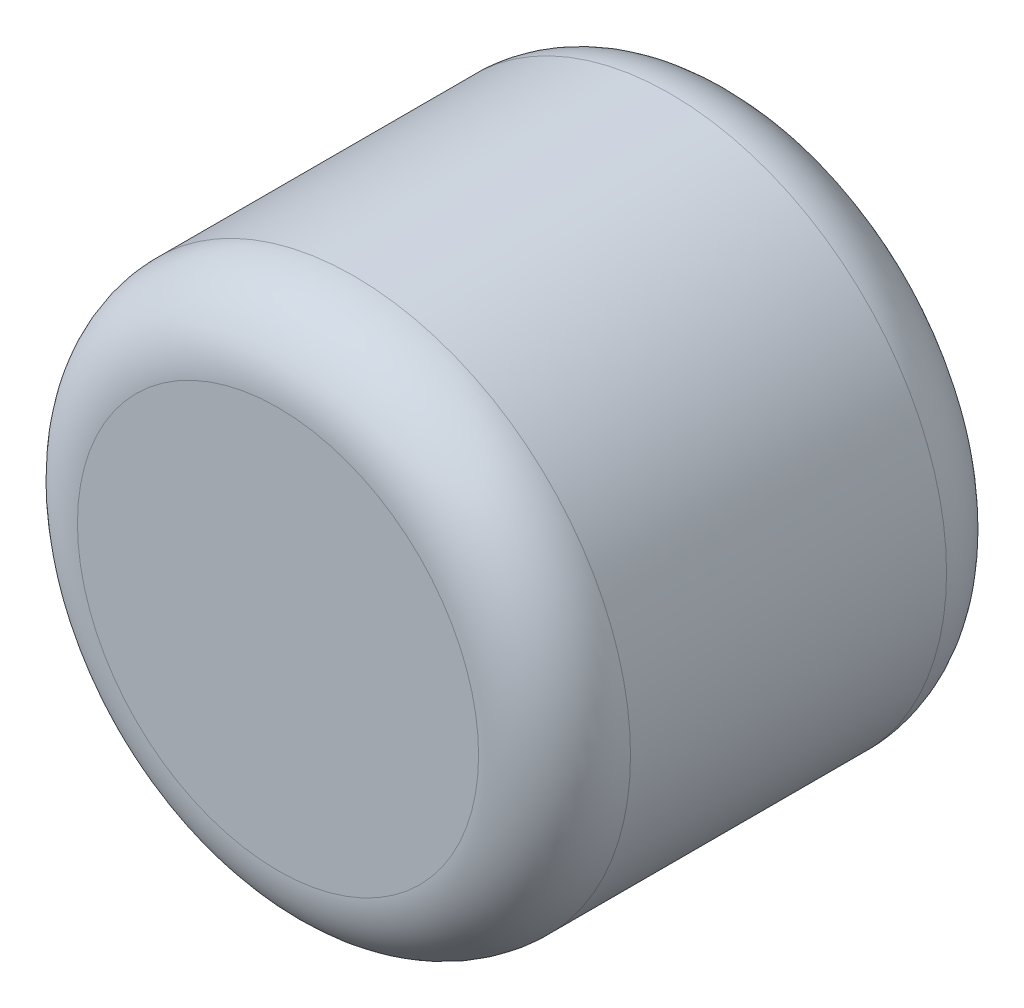
from build123d import *

# Parameters (mm, degrees)
SKETCH1_R           = 4.6228
BOSS_EXTRUDE1_DEPTH = 7.8232
FILLET1_R           = 1.27


with BuildPart() as part:
    # Sketch1 → Boss-Extrude1 (new body)
    with BuildSketch(Plane.XY):
        Circle(SKETCH1_R)
    extrude(amount=BOSS_EXTRUDE1_DEPTH)

    # Fillet1
    fillet1_edges = [part.edges().sort_by_distance(p)[0] for p in [
        (-4.6228, 0, 0),
        (-4.6228, 0, 7.8232),
    ]]
    fillet(fillet1_edges, radius=FILLET1_R)


solid = part.part
